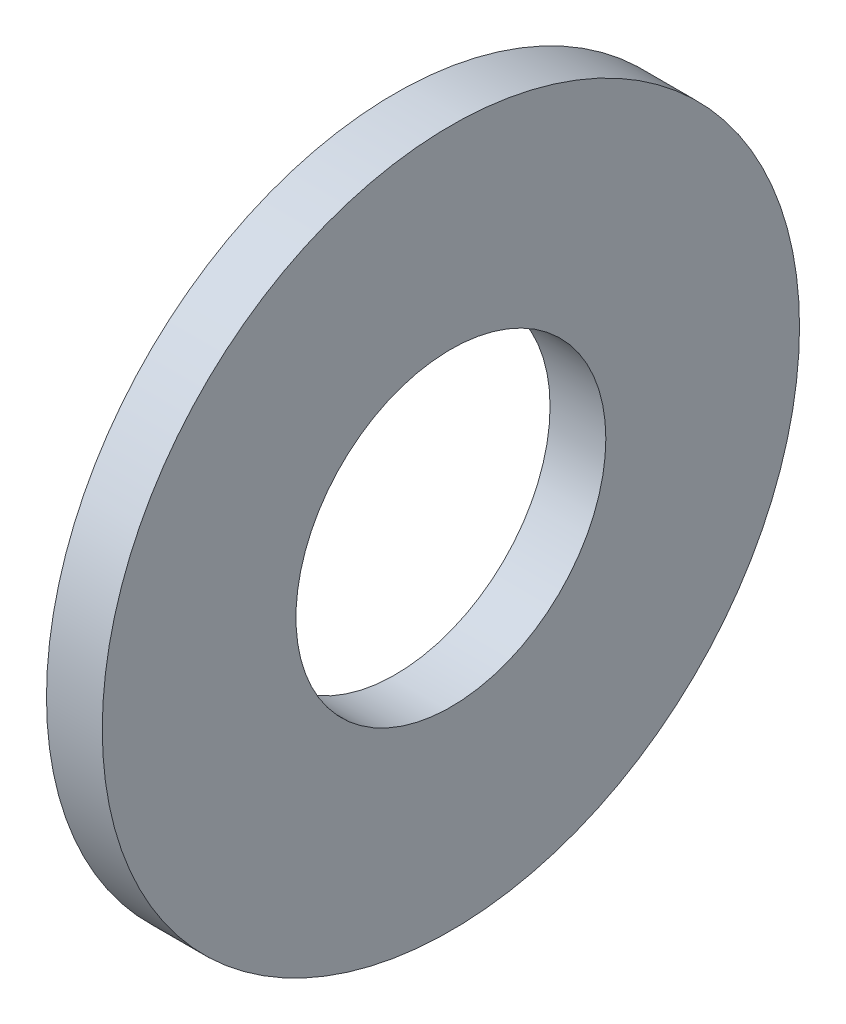
from build123d import *

# Parameters (mm, degrees)
SKETCH1_R           = 5.715
SKETCH1_R_2         = 2.54
BOSS_EXTRUDE1_DEPTH = 0.9144


with BuildPart() as part:
    # Sketch1 → Boss-Extrude1 (new body)
    with BuildSketch(Plane(origin=(0, 0, 0), x_dir=(0, 0, -1), z_dir=(1, 0, 0))):
        Circle(SKETCH1_R)
        Circle(SKETCH1_R_2, mode=Mode.SUBTRACT)
    extrude(amount=BOSS_EXTRUDE1_DEPTH)


solid = part.part
